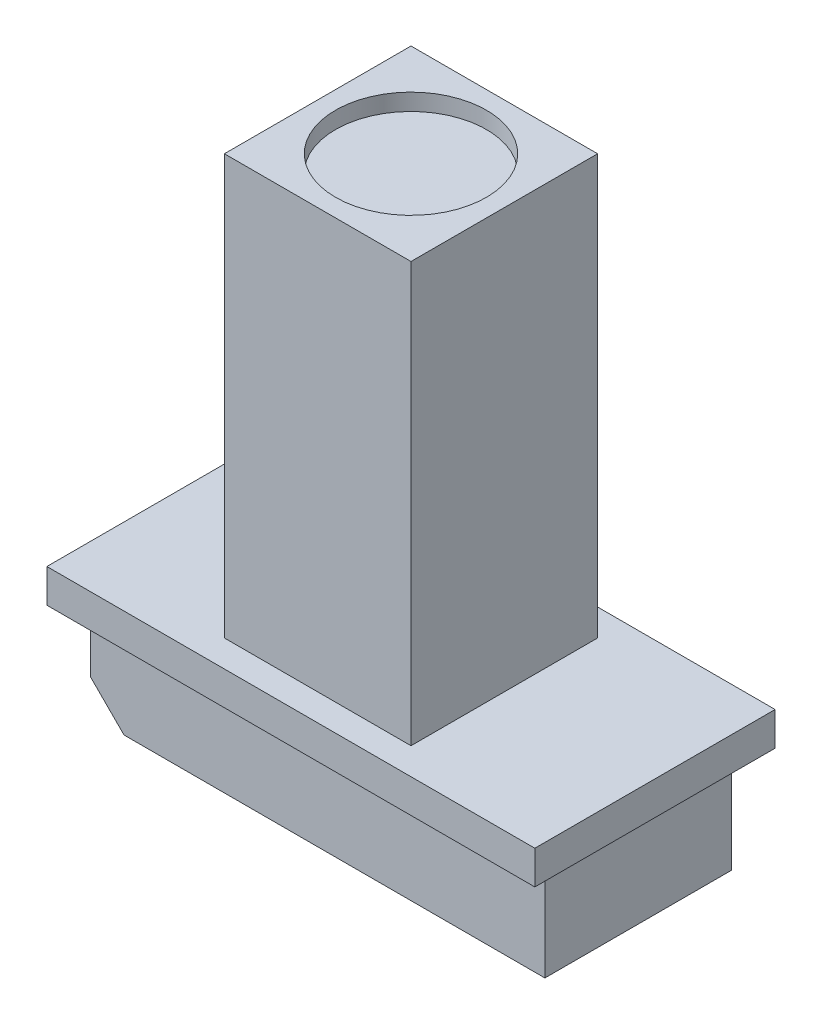
from build123d import *

# Parameters (mm, degrees)
SKETCH_1_W          = 5.562046036
SKETCH_1_H          = 5.562046036
EXTRUDE_2_DEPTH     = 12.5
SKETCH_5_R          = 2.25
CUT_EXTRUDE_2_DEPTH = 0.5
SKETCH_6_W          = 14.543974178
SKETCH_6_H          = 7.162046036
EXTRUDE_3_DEPTH     = 1
SKETCH_7_W          = 13.543974178
SKETCH_7_H          = 5.562046036
EXTRUDE_4_DEPTH     = 3
CHAMFER_2_SIZE      = 1


with BuildPart() as part:
    # Эскиз1 → Бобышка-Вытянуть2 (new body)
    with BuildSketch(Plane(origin=(0, 0, 0), x_dir=(1, 0, 0), z_dir=(0, 1, 0))):
        Rectangle(SKETCH_1_W, SKETCH_1_H)
    extrude(amount=EXTRUDE_2_DEPTH)

    # Эскиз5 → Вырез-Вытянуть2 (cut)
    with BuildSketch(Plane(origin=(0, 12.5, 0), x_dir=(1, 0, 0), z_dir=(0, 1, 0))):
        with Locations(Location((0, 0, 0), (0, 0, 270))):
            Circle(SKETCH_5_R)
    extrude(amount=-CUT_EXTRUDE_2_DEPTH, mode=Mode.SUBTRACT)


with BuildPart() as body_2:
    # Эскиз6 → Бобышка-Вытянуть3 (new body)
    with BuildSketch(Plane.XZ):
        Rectangle(SKETCH_6_W, SKETCH_6_H)
    extrude(amount=EXTRUDE_3_DEPTH)

    # Эскиз7 → Бобышка-Вытянуть4 (add)
    with BuildSketch(Plane.XZ.offset(1)):
        Rectangle(SKETCH_7_W, SKETCH_7_H)
    extrude(amount=EXTRUDE_4_DEPTH)

    # Фаска2
    chamfer_2_edges = [body_2.edges().sort_by_distance(p)[0] for p in [
        (-6.771987089, -4, 0),
    ]]
    chamfer(chamfer_2_edges, length=CHAMFER_2_SIZE)


solid = Compound([part.part, body_2.part])
